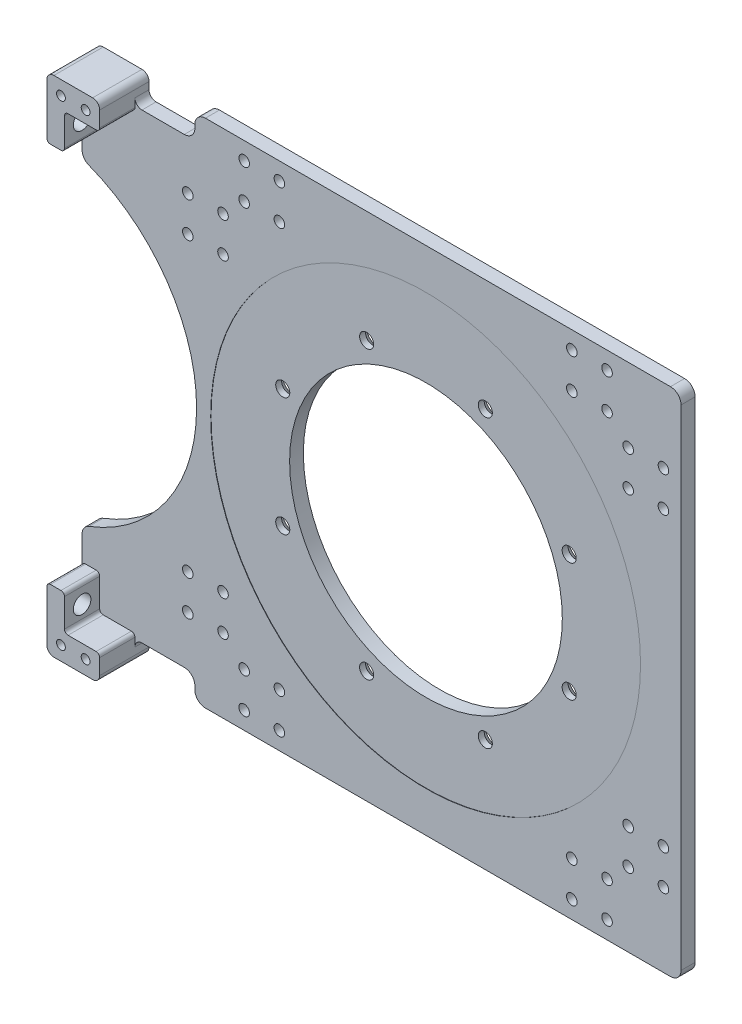
from build123d import *

# Parameters (mm, degrees)
SKETCH_1_W          = 145
SKETCH_1_H          = 145
SKETCH_1_R          = 38.7
SKETCH_1_R_2        = 2
SKETCH_1_R_3        = 1.5
EXTRUDE_1_DEPTH     = 4
SKETCH_2_R          = 61
CUT_EXTRUDE_1_DEPTH = 0.1
EXTRUDE_2_DEPTH     = 4
CHAMFER_1_SIZE      = 2.2
CUT_EXTRUDE_2_DEPTH = 3
FILLET_3_R          = 3
SKETCH_5_R          = 47.5
SKETCH_5_W          = 25
SKETCH_5_H          = 7
CUT_EXTRUDE_3_DEPTH = 4
FILLET_4_R          = 3
SKETCH_7_W          = 15
SKETCH_7_H          = 6
EXTRUDE_3_DEPTH     = 4
SKETCH_8_R          = 1.25
EXTRUDE_4_DEPTH     = 10
SKETCH_9_R          = 2.5
CUT_EXTRUDE_4_DEPTH = 10
CUT_EXTRUDE_START   = -10
SKETCH_10_R         = 1.25
CUT_EXTRUDE_5_DEPTH = 10
FILLET_5_R          = 2
FILLET_6_R          = 1


with BuildPart() as part:
    # 草图1 → 凸台-拉伸1 (new body)
    with BuildSketch(Plane.XY):
        Rectangle(SKETCH_1_W, SKETCH_1_H)
        Circle(SKETCH_1_R, mode=Mode.SUBTRACT)
        with Locations((16.838071024, 40.65069943)):
            Circle(SKETCH_1_R_2, mode=Mode.SUBTRACT)
        with Locations((40.65069943, 16.838071024)):
            Circle(SKETCH_1_R_2, mode=Mode.SUBTRACT)
        with Locations((40.65069943, -16.838071024)):
            Circle(SKETCH_1_R_2, mode=Mode.SUBTRACT)
        with Locations((16.838071024, -40.65069943)):
            Circle(SKETCH_1_R_2, mode=Mode.SUBTRACT)
        with Locations((-16.838071024, -40.65069943)):
            Circle(SKETCH_1_R_2, mode=Mode.SUBTRACT)
        with Locations((-40.65069943, -16.838071024)):
            Circle(SKETCH_1_R_2, mode=Mode.SUBTRACT)
        with Locations((-40.65069943, 16.838071024)):
            Circle(SKETCH_1_R_2, mode=Mode.SUBTRACT)
        with Locations((-16.838071024, 40.65069943)):
            Circle(SKETCH_1_R_2, mode=Mode.SUBTRACT)
        with Locations((41.5, -67.5)):
            Circle(SKETCH_1_R_3, mode=Mode.SUBTRACT)
        with Locations((51.5, -67.5)):
            Circle(SKETCH_1_R_3, mode=Mode.SUBTRACT)
        with Locations((41.5, -57.5)):
            Circle(SKETCH_1_R_3, mode=Mode.SUBTRACT)
        with Locations((51.5, -57.5)):
            Circle(SKETCH_1_R_3, mode=Mode.SUBTRACT)
        with Locations((57.5, -51.5)):
            Circle(SKETCH_1_R_3, mode=Mode.SUBTRACT)
        with Locations((57.5, -41.5)):
            Circle(SKETCH_1_R_3, mode=Mode.SUBTRACT)
        with Locations((67.5, -41.5)):
            Circle(SKETCH_1_R_3, mode=Mode.SUBTRACT)
        with Locations((67.5, -51.5)):
            Circle(SKETCH_1_R_3, mode=Mode.SUBTRACT)
        with Locations((-51.5, -67.5)):
            Circle(SKETCH_1_R_3, mode=Mode.SUBTRACT)
        with Locations((-41.5, -67.5)):
            Circle(SKETCH_1_R_3, mode=Mode.SUBTRACT)
        with Locations((-41.5, -57.5)):
            Circle(SKETCH_1_R_3, mode=Mode.SUBTRACT)
        with Locations((-51.5, -57.5)):
            Circle(SKETCH_1_R_3, mode=Mode.SUBTRACT)
        with Locations((-57.5, -51.5)):
            Circle(SKETCH_1_R_3, mode=Mode.SUBTRACT)
        with Locations((-57.5, -41.5)):
            Circle(SKETCH_1_R_3, mode=Mode.SUBTRACT)
        with Locations((-67.5, -41.5)):
            Circle(SKETCH_1_R_3, mode=Mode.SUBTRACT)
        with Locations((-67.5, -51.5)):
            Circle(SKETCH_1_R_3, mode=Mode.SUBTRACT)
        with Locations((-41.5, 67.5)):
            Circle(SKETCH_1_R_3, mode=Mode.SUBTRACT)
        with Locations((-41.5, 57.5)):
            Circle(SKETCH_1_R_3, mode=Mode.SUBTRACT)
        with Locations((-51.5, 57.5)):
            Circle(SKETCH_1_R_3, mode=Mode.SUBTRACT)
        with Locations((-51.5, 67.5)):
            Circle(SKETCH_1_R_3, mode=Mode.SUBTRACT)
        with Locations((51.5, 57.5)):
            Circle(SKETCH_1_R_3, mode=Mode.SUBTRACT)
        with Locations((51.5, 67.5)):
            Circle(SKETCH_1_R_3, mode=Mode.SUBTRACT)
        with Locations((41.5, 67.5)):
            Circle(SKETCH_1_R_3, mode=Mode.SUBTRACT)
        with Locations((41.5, 57.5)):
            Circle(SKETCH_1_R_3, mode=Mode.SUBTRACT)
        with Locations((57.5, 51.5)):
            Circle(SKETCH_1_R_3, mode=Mode.SUBTRACT)
        with Locations((57.5, 41.5)):
            Circle(SKETCH_1_R_3, mode=Mode.SUBTRACT)
        with Locations((67.5, 41.5)):
            Circle(SKETCH_1_R_3, mode=Mode.SUBTRACT)
        with Locations((67.5, 51.5)):
            Circle(SKETCH_1_R_3, mode=Mode.SUBTRACT)
        with Locations((-67.5, 41.5)):
            Circle(SKETCH_1_R_3, mode=Mode.SUBTRACT)
        with Locations((-57.5, 41.5)):
            Circle(SKETCH_1_R_3, mode=Mode.SUBTRACT)
        with Locations((-67.5, 51.5)):
            Circle(SKETCH_1_R_3, mode=Mode.SUBTRACT)
        with Locations((-57.5, 51.5)):
            Circle(SKETCH_1_R_3, mode=Mode.SUBTRACT)
    extrude(amount=EXTRUDE_1_DEPTH)

    # 草图2 → 切除-拉伸1 (cut)
    with BuildSketch(Plane.XY.offset(4)):
        Circle(SKETCH_2_R)
    extrude(amount=-CUT_EXTRUDE_1_DEPTH, mode=Mode.SUBTRACT)

    # 草图3 → 凸台-拉伸2 (add)
    with BuildSketch(Plane(origin=(0, 0, 0), x_dir=(-1, 0, 0), z_dir=(0, 0, -1))):
        with BuildLine():
            ThreePointArc((72.5, 25.617376915), (83.330748854, 37.488728807), (97.5, 45.069390943))
            Line((97.5, 45.069390943), (97.5, 65.5))
            Line((97.5, 65.5), (90.5, 65.5))
            Line((90.5, 65.5), (90.5, 72.5))
            Line((90.5, 72.5), (72.5, 72.5))
            Line((72.5, 72.5), (72.5, 25.617376915))
        make_face()
        with BuildLine():
            Line((72.5, -72.5), (90.5, -72.5))
            Line((90.5, -72.5), (90.5, -65.5))
            Line((90.5, -65.5), (97.5, -65.5))
            Line((97.5, -65.5), (97.5, -45.069390943))
            ThreePointArc((97.5, -45.069390943), (83.330748854, -37.488728807), (72.5, -25.617376915))
            Line((72.5, -25.617376915), (72.5, -72.5))
        make_face()
        with BuildLine():
            ThreePointArc((72.5, 25.617376915), (65, 0), (72.5, -25.617376915))
            Line((72.5, -25.617376915), (72.5, 25.617376915))
        make_face()
    extrude(amount=-EXTRUDE_2_DEPTH)

    # 倒角1
    chamfer_1_edges = [part.edges().sort_by_distance(p)[0] for p in [
        (14.838071024, 40.65069943, 0),
        (38.65069943, 16.838071024, 0),
        (38.65069943, -16.838071024, 0),
        (14.838071024, -40.65069943, 0),
        (-18.838071024, -40.65069943, 0),
        (-42.65069943, -16.838071024, 0),
        (-42.65069943, 16.838071024, 0),
        (-18.838071024, 40.65069943, 0),
    ]]
    chamfer(chamfer_1_edges, length=CHAMFER_1_SIZE)

    # 草图4 → 切除-拉伸2 (cut)
    with BuildSketch(Plane(origin=(0, 0, 0), x_dir=(-1, 0, 0), z_dir=(0, 0, -1))):
        with BuildLine():
            Line((-43.494252494, 28.5), (-65.5, 28.5))
            Line((-65.5, 28.5), (-65.5, -28.5))
            Line((-65.5, -28.5), (-43.494252494, -28.5))
            ThreePointArc((-43.494252494, -28.5), (-52, 0), (-43.494252494, 28.5))
        make_face()
        with BuildLine():
            Line((-50.5, 34.5), (-38.906940255, 34.5))
            ThreePointArc((-38.906940255, 34.5), (-36.769552622, 36.769552622), (-34.5, 38.906940255))
            Line((-34.5, 38.906940255), (-34.5, 50.5))
            Line((-34.5, 50.5), (-50.5, 50.5))
            Line((-50.5, 50.5), (-50.5, 34.5))
        make_face()
        with BuildLine():
            ThreePointArc((-34.5, -38.906940255), (-36.769552622, -36.769552622), (-38.906940255, -34.5))
            Line((-38.906940255, -34.5), (-50.5, -34.5))
            Line((-50.5, -34.5), (-50.5, -50.5))
            Line((-50.5, -50.5), (-34.5, -50.5))
            Line((-34.5, -50.5), (-34.5, -38.906940255))
        make_face()
        with BuildLine():
            Line((-28.5, 65.5), (-28.5, 43.494252494))
            ThreePointArc((-28.5, 43.494252494), (0, 52), (28.5, 43.494252494))
            Line((28.5, 43.494252494), (28.5, 65.5))
            Line((28.5, 65.5), (-28.5, 65.5))
        make_face()
        with BuildLine():
            ThreePointArc((28.5, -43.494252494), (0, -52), (-28.5, -43.494252494))
            Line((-28.5, -43.494252494), (-28.5, -65.5))
            Line((-28.5, -65.5), (28.5, -65.5))
            Line((28.5, -65.5), (28.5, -43.494252494))
        make_face()
        with BuildLine():
            Line((34.5, 50.5), (34.5, 38.906940255))
            ThreePointArc((34.5, 38.906940255), (36.769552622, 36.769552622), (38.906940255, 34.5))
            Line((38.906940255, 34.5), (50.5, 34.5))
            Line((50.5, 34.5), (50.5, 50.5))
            Line((50.5, 50.5), (34.5, 50.5))
        make_face()
        with BuildLine():
            ThreePointArc((38.906940255, -34.5), (36.769552622, -36.769552622), (34.5, -38.906940255))
            Line((34.5, -38.906940255), (34.5, -50.5))
            Line((34.5, -50.5), (50.5, -50.5))
            Line((50.5, -50.5), (50.5, -34.5))
            Line((50.5, -34.5), (38.906940255, -34.5))
        make_face()
        with BuildLine():
            Line((65.5, 28.5), (43.494252494, 28.5))
            ThreePointArc((43.494252494, 28.5), (52, 0), (43.494252494, -28.5))
            Line((43.494252494, -28.5), (65.5, -28.5))
            Line((65.5, -28.5), (65.5, 28.5))
        make_face()
    extrude(amount=-CUT_EXTRUDE_2_DEPTH, mode=Mode.SUBTRACT)

    # 圆角3
    fillet_3_edges = [part.edges().sort_by_distance(p)[0] for p in [
        (-28.5, 43.494252494, 1.5),
        (28.5, 43.494252494, 1.5),
        (28.5, 65.5, 1.5),
        (-28.5, 65.5, 1.5),
        (-38.906940255, 34.5, 1.5),
        (-34.5, 38.906940255, 1.5),
        (-34.5, 50.5, 1.5),
        (-50.5, 50.5, 1.5),
        (-50.5, 34.5, 1.5),
        (-43.494252494, -28.5, 1.5),
        (-43.494252494, 28.5, 1.5),
        (-65.5, 28.5, 1.5),
        (-65.5, -28.5, 1.5),
        (-34.5, -38.906940255, 1.5),
        (-38.906940255, -34.5, 1.5),
        (-50.5, -34.5, 1.5),
        (-50.5, -50.5, 1.5),
        (-34.5, -50.5, 1.5),
        (38.906940255, -34.5, 1.5),
        (34.5, -38.906940255, 1.5),
        (34.5, -50.5, 1.5),
        (50.5, -50.5, 1.5),
        (50.5, -34.5, 1.5),
        (28.5, -43.494252494, 1.5),
        (-28.5, -43.494252494, 1.5),
        (-28.5, -65.5, 1.5),
        (28.5, -65.5, 1.5),
        (43.494252494, 28.5, 1.5),
        (43.494252494, -28.5, 1.5),
        (65.5, -28.5, 1.5),
        (65.5, 28.5, 1.5),
        (34.5, 38.906940255, 1.5),
        (38.906940255, 34.5, 1.5),
        (50.5, 34.5, 1.5),
        (50.5, 50.5, 1.5),
        (34.5, 50.5, 1.5),
    ]]
    fillet(fillet_3_edges, radius=FILLET_3_R)

    # 草图5 → 切除-拉伸3 (cut)
    with BuildSketch(Plane(origin=(0, 0, 0), x_dir=(-1, 0, 0), z_dir=(0, 0, -1))):
        with Locations((112.5, 0)):
            Circle(SKETCH_5_R)
        with Locations((78, 69)):
            Rectangle(SKETCH_5_W, SKETCH_5_H)
        with Locations((78, -69)):
            Rectangle(SKETCH_5_W, SKETCH_5_H)
    extrude(amount=-CUT_EXTRUDE_3_DEPTH, mode=Mode.SUBTRACT)

    # 圆角4
    fillet_4_edges = [part.edges().sort_by_distance(p)[0] for p in [
        (-97.5, 45.069390943, 2),
        (-97.5, -45.069390943, 2),
        (-65.5, 65.5, 2),
        (-65.5, 72.5, 2),
        (-65.5, -72.5, 2),
        (-65.5, -65.5, 2),
        (-65.5, -6.873863542, 1.5),
        (-65.5, 6.873863542, 1.5),
        (72.5, -72.5, 2),
        (72.5, 72.5, 2),
    ]]
    fillet(fillet_4_edges, radius=FILLET_4_R)

    # 草图7 → 凸台-拉伸3 (add)
    with BuildSketch(Plane(origin=(0, 0, 0), x_dir=(-1, 0, 0), z_dir=(0, 0, -1))):
        with Locations((90, -68.5)):
            Rectangle(SKETCH_7_W, SKETCH_7_H)
    extrude_3 = extrude(amount=-EXTRUDE_3_DEPTH)

    # 草图8 → 凸台-拉伸4 (add)
    with BuildSketch(Plane.XY.offset(4)):
        Polygon((-82.5, -71.5), (-97.5, -71.5), (-97.5, -54.1), (-92.5, -54.1), (-92.5, -64.1), (-82.5, -64.1), (-82.5, -65.5), align=None)
        with Locations((-93.5, -67.5)):
            Circle(SKETCH_8_R, mode=Mode.SUBTRACT)
        with Locations((-86.5, -67.5)):
            Circle(SKETCH_8_R, mode=Mode.SUBTRACT)
    extrude_4 = extrude(amount=EXTRUDE_4_DEPTH)

    # 草图9 → 切除-拉伸4 (cut)
    with BuildSketch(Plane(origin=(-92.5, 0, 0), x_dir=(0, 0, -1), z_dir=(1, 0, 0))):
        with Locations((-9, -59.5)):
            Circle(SKETCH_9_R)
    cut_extrude_4 = extrude(amount=-CUT_EXTRUDE_4_DEPTH, mode=Mode.SUBTRACT)

    # 草图10 → 切除-拉伸5 (cut)
    with BuildSketch(Plane.XY.offset(4).offset(CUT_EXTRUDE_START)):
        with Locations((-93.5, -67.5)):
            Circle(SKETCH_10_R)
        with Locations((-86.5, -67.5)):
            Circle(SKETCH_10_R)
    cut_extrude_5 = extrude(amount=CUT_EXTRUDE_5_DEPTH, mode=Mode.SUBTRACT)

    # 镜向1: 凸台-拉伸3, 凸台-拉伸4, 切除-拉伸4, 切除-拉伸5 across plane
    add(extrude_3.mirror(Plane.ZX))
    add(extrude_4.mirror(Plane.ZX))
    add(cut_extrude_4.mirror(Plane.ZX), mode=Mode.SUBTRACT)
    add(cut_extrude_5.mirror(Plane.ZX), mode=Mode.SUBTRACT)

    # 圆角5
    fillet_5_edges = [part.edges().sort_by_distance(p)[0] for p in [
        (-82.5, -71.5, 7),
        (-82.5, -65.5, 2),
        (-97.5, -71.5, 7),
        (-82.5, 65.5, 2),
        (-82.5, 71.5, 7),
        (-97.5, 71.5, 7),
    ]]
    fillet(fillet_5_edges, radius=FILLET_5_R)

    # 圆角6
    fillet_6_edges = [part.edges().sort_by_distance(p)[0] for p in [
        (-82.5, -64.1, 9),
        (-92.5, -64.1, 9),
        (-92.5, -54.1, 9),
        (-97.5, -54.1, 9),
        (-97.5, 54.1, 9),
        (-92.5, 54.1, 9),
        (-92.5, 64.1, 9),
        (-82.5, 64.1, 9),
    ]]
    fillet(fillet_6_edges, radius=FILLET_6_R)


solid = part.part
